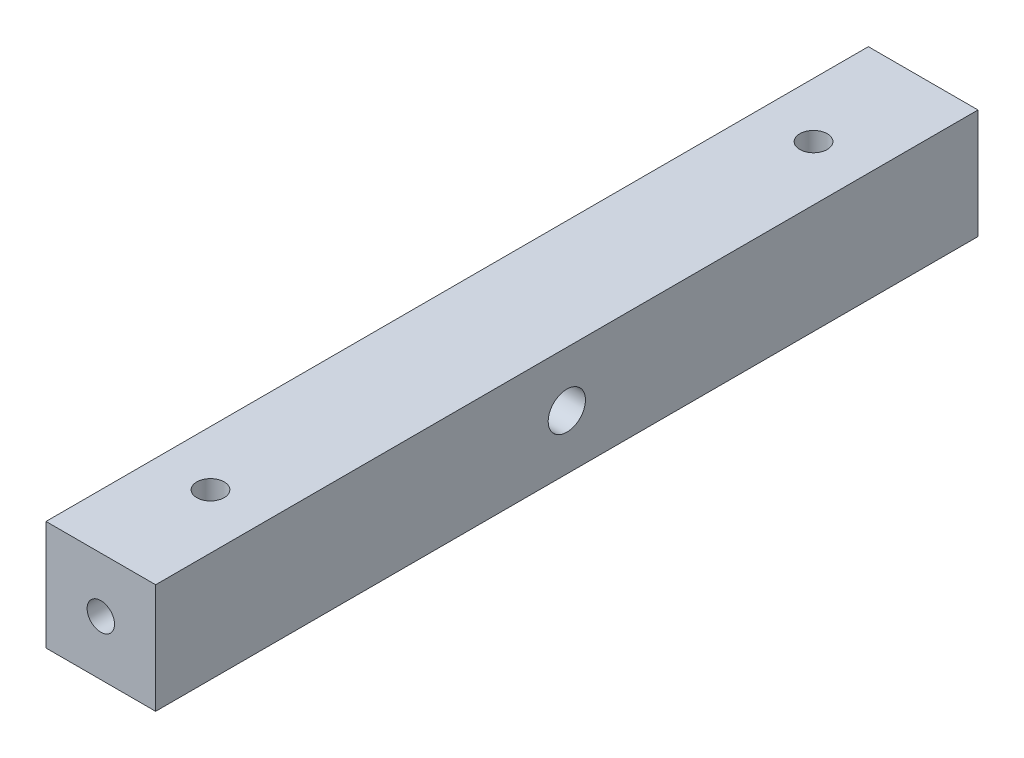
from build123d import *

# Parameters (mm, degrees)
SKETCH1_W                                       = 10
SKETCH1_H                                       = 10
BOSS_EXTRUDE1_DEPTH                             = 75
M3X0_5_TAPPED_HOLE1_D                           = 2.5
M3X0_5_TAPPED_HOLE1_DEPTH                       = 7.5
M3X0_5_TAPPED_HOLE1_TIP                         = 0.751075774
M3X0_5_TAPPED_HOLE2_D                           = 2.5
M3X0_5_TAPPED_HOLE2_DEPTH                       = 7.5
M3X0_5_TAPPED_HOLE2_TIP                         = 0.751075774
CSK_FOR_M3_OVAL_HEAD_MACHINE_SCREW1_D           = 3.4
CSK_FOR_M3_OVAL_HEAD_MACHINE_SCREW1_CSINK_D     = 6.3
CSK_FOR_M3_OVAL_HEAD_MACHINE_SCREW1_CSINK_ANGLE = 90
M3X0_5_TAPPED_HOLE3_D                           = 2.5


with BuildPart() as part:
    # Sketch1 → Boss-Extrude1 (new body)
    with BuildSketch(Plane.XY):
        with Locations((32.5, -32.5)):
            Rectangle(SKETCH1_W, SKETCH1_H)
    extrude(amount=BOSS_EXTRUDE1_DEPTH)

    # M3x0.5 Tapped Hole1
    with Locations(Plane.XY.offset(75)):
        with Locations((32.5, -32.5)):
            Hole(M3X0_5_TAPPED_HOLE1_D / 2, depth=M3X0_5_TAPPED_HOLE1_DEPTH)
            with Locations((0, 0, -(M3X0_5_TAPPED_HOLE1_DEPTH + M3X0_5_TAPPED_HOLE1_TIP / 2))):  # 118° drill point
                Cone(0, M3X0_5_TAPPED_HOLE1_D / 2, M3X0_5_TAPPED_HOLE1_TIP, mode=Mode.SUBTRACT)

    # M3x0.5 Tapped Hole2
    with Locations(Plane(origin=(0, 0, 0), x_dir=(-1, 0, 0), z_dir=(0, 0, -1))):
        with Locations((-32.5, -32.5)):
            Hole(M3X0_5_TAPPED_HOLE2_D / 2, depth=M3X0_5_TAPPED_HOLE2_DEPTH)
            with Locations((0, 0, -(M3X0_5_TAPPED_HOLE2_DEPTH + M3X0_5_TAPPED_HOLE2_TIP / 2))):  # 118° drill point
                Cone(0, M3X0_5_TAPPED_HOLE2_D / 2, M3X0_5_TAPPED_HOLE2_TIP, mode=Mode.SUBTRACT)

    # CSK for M3 Oval Head Machine Screw1 (through all)
    with Locations(Plane(origin=(27.5, -32.5, 37.5), x_dir=(0, 0, -1), z_dir=(-1, 0, 0))):
        with Locations((0, 0)):
            CounterSinkHole(CSK_FOR_M3_OVAL_HEAD_MACHINE_SCREW1_D / 2, CSK_FOR_M3_OVAL_HEAD_MACHINE_SCREW1_CSINK_D / 2, counter_sink_angle=CSK_FOR_M3_OVAL_HEAD_MACHINE_SCREW1_CSINK_ANGLE)

    # M3x0.5 Tapped Hole3 (through all)
    with Locations(Plane(origin=(0, -27.5, 0), x_dir=(-1, 0, 0), z_dir=(0, 1, 0))):
        with Locations((-32.5, 65), (-32.5, 10)):
            Hole(M3X0_5_TAPPED_HOLE3_D / 2)


solid = part.part
